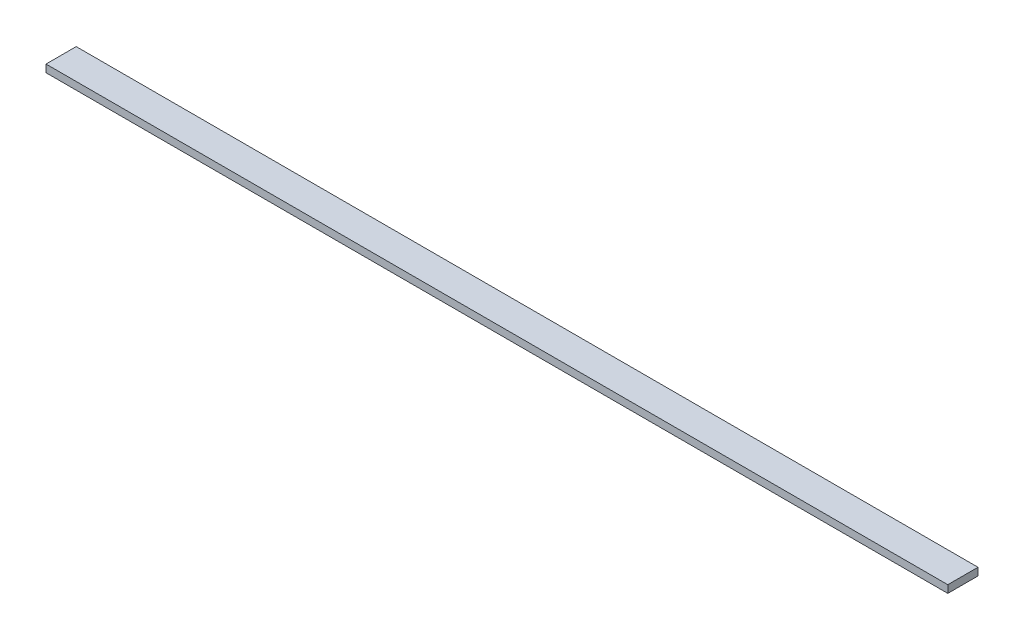
from build123d import *

# Parameters (mm, degrees)
SKETCH1_W           = 19.05
SKETCH1_H           = 4.7625
BOSS_EXTRUDE1_DEPTH = 284.375


with BuildPart() as part:
    # Sketch1 → Boss-Extrude1 (new, symmetric)
    with BuildSketch(Plane(origin=(0, 0, 0), x_dir=(0, 0, -1), z_dir=(1, 0, 0))):
        Rectangle(SKETCH1_W, SKETCH1_H)
    extrude(amount=BOSS_EXTRUDE1_DEPTH, both=True)


solid = part.part
